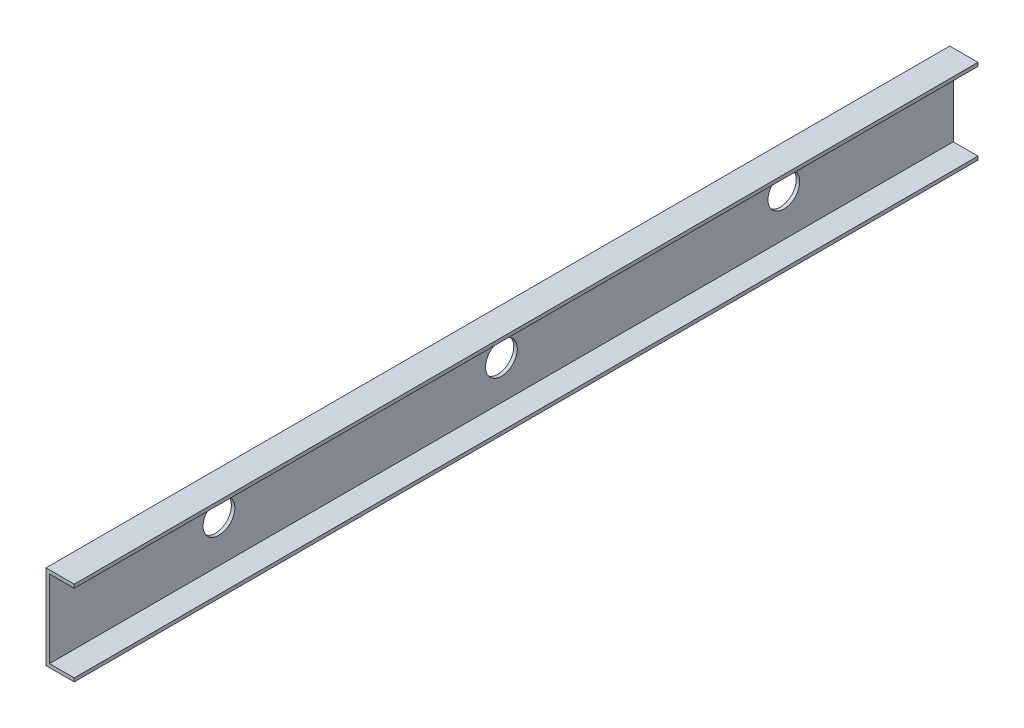
from build123d import *

# Parameters (mm, degrees)
BOSS_EXTRUDE1_DEPTH = 812.8
SKETCH2_R           = 14.2875
CUT_EXTRUDE1_DEPTH  = 817.469013879


with BuildPart() as part:
    # Sketch1 → Boss-Extrude1 (new body)
    with BuildSketch(Plane.XY):
        Polygon((0, 0), (0, 69.85), (22.225, 69.85), (22.225, 73.025), (-3.175, 73.025), (-3.175, -3.175), (22.225, -3.175), (22.225, 0), align=None)
    extrude(amount=BOSS_EXTRUDE1_DEPTH)

    # Sketch2 → Cut-Extrude1 (cut, through all)
    with BuildSketch(Plane.ZY.offset(3.175)):
        with Locations((406.4, 34.925)):
            Circle(SKETCH2_R)
        with Locations((152.4, 38.1)):
            Circle(SKETCH2_R)
        with Locations((660.4, 38.1)):
            Circle(SKETCH2_R)
    extrude(amount=-CUT_EXTRUDE1_DEPTH, mode=Mode.SUBTRACT)


solid = part.part
